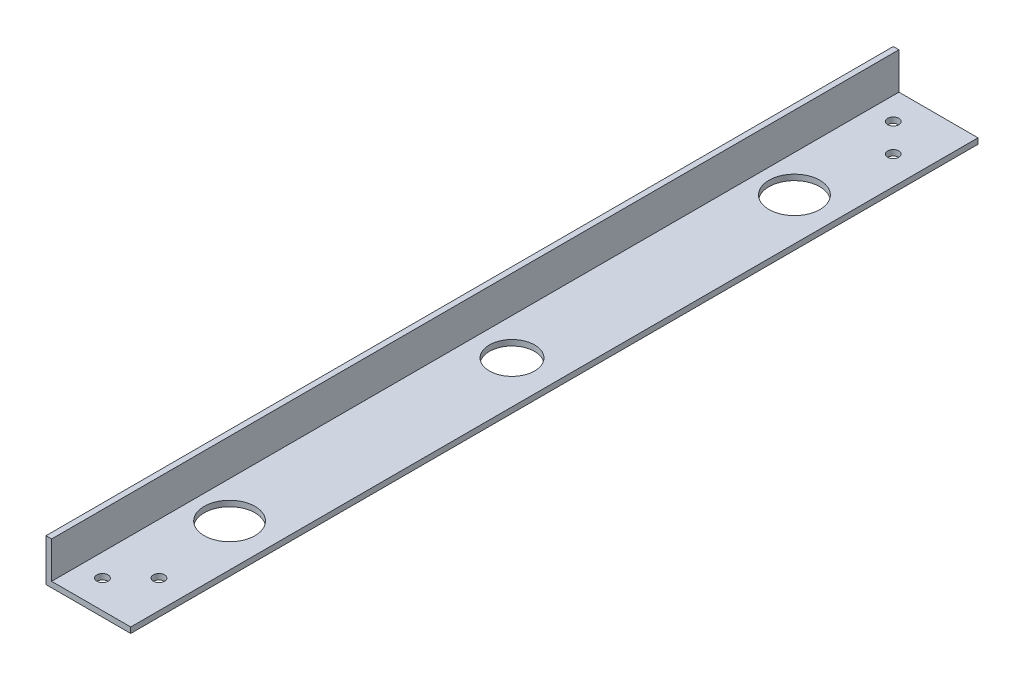
from build123d import *

# Parameters (mm, degrees)
BOSS_EXTRUDE1_DEPTH = 300
SKETCH2_R           = 8
SKETCH2_R_2         = 1.977693409
CUT_EXTRUDE1_DEPTH  = 10
SKETCH3_W           = 300
SKETCH3_H           = 10
CUT_EXTRUDE2_DEPTH  = 10
SKETCH6_R           = 9
CUT_EXTRUDE5_DEPTH  = 5


with BuildPart() as part:
    # Sketch1 → Boss-Extrude1 (new body)
    with BuildSketch(Plane.XY):
        Polygon((0, 0), (0, 25), (2, 25), (2, 2), (30, 2), (30, 0), align=None)
    extrude(amount=BOSS_EXTRUDE1_DEPTH)

    # Sketch2 → Cut-Extrude1 (cut)
    with BuildSketch(Plane(origin=(0, 2, 0), x_dir=(1, 0, 0), z_dir=(0, 1, 0))):
        with Locations(Location((15, -150, 0), (0, 0, 180))):
            Circle(SKETCH2_R)
        with Locations(Location((10, -10, 0), (0, 0, 180))):
            Circle(SKETCH2_R_2)
        with Locations(Location((20, -20, 0), (0, 0, 180))):
            Circle(SKETCH2_R_2)
        with Locations(Location((10, -290, 0), (0, 0, 180))):
            Circle(SKETCH2_R_2)
        with Locations(Location((20, -280, 0), (0, 0, 180))):
            Circle(SKETCH2_R_2)
    extrude(amount=-CUT_EXTRUDE1_DEPTH, mode=Mode.SUBTRACT)

    # Sketch3 → Cut-Extrude2 (cut)
    with BuildSketch(Plane(origin=(2, 0, 0), x_dir=(0, 0, -1), z_dir=(1, 0, 0))):
        with Locations((-150, 20)):
            Rectangle(SKETCH3_W, SKETCH3_H)
    extrude(amount=-CUT_EXTRUDE2_DEPTH, mode=Mode.SUBTRACT)

    # Sketch6 → Cut-Extrude5 (cut)
    with BuildSketch(Plane.XZ):
        with Locations((15, 250)):
            Circle(SKETCH6_R)
        with Locations((15, 50)):
            Circle(SKETCH6_R)
        with Locations((-238, 50)):
            Circle(SKETCH6_R)
        with Locations((-238, 250)):
            Circle(SKETCH6_R)
    extrude(amount=-CUT_EXTRUDE5_DEPTH, mode=Mode.SUBTRACT)


solid = part.part
